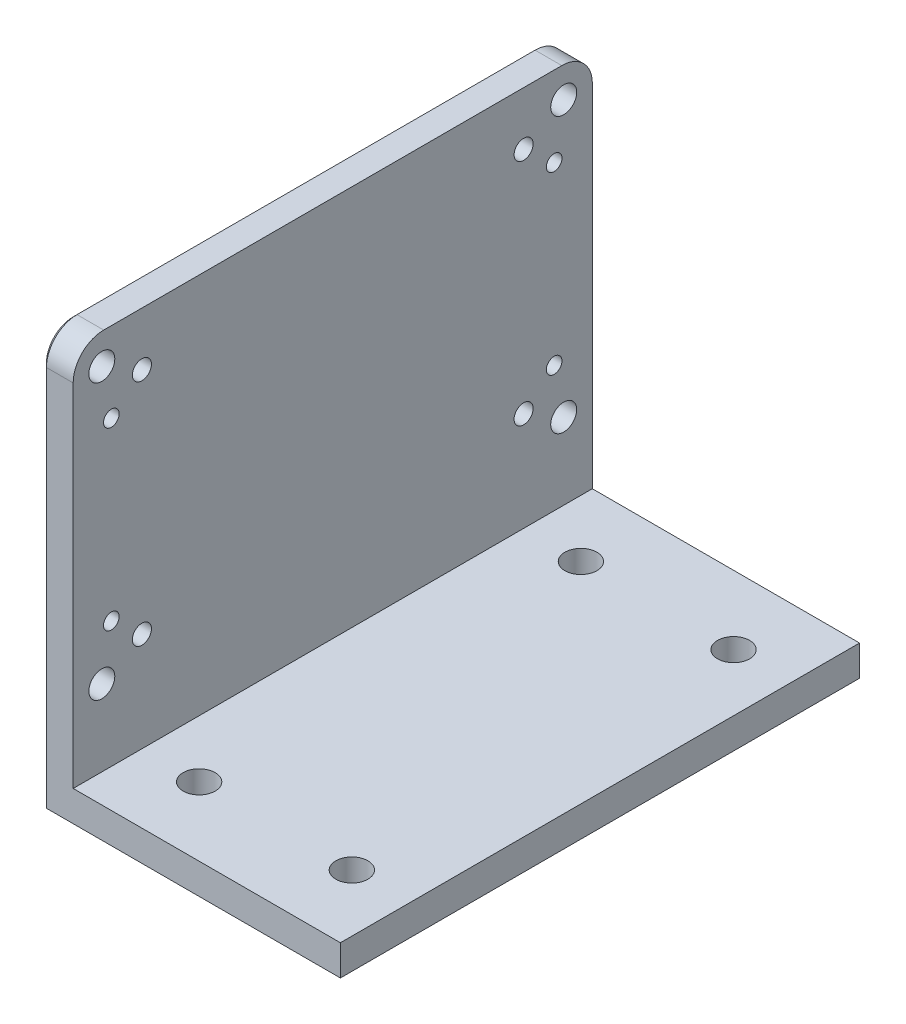
from build123d import *

# Parameters (mm, degrees)
BOSS_EXTRUDE1_DEPTH          = 68
M3_CLEARANCE_HOLE1_D         = 3.4
M3_CLEARANCE_HOLE1_DEPTH     = 5
M3_CLEARANCE_HOLE1_TIP       = 1.021463052
M5X0_8_TAPPED_HOLE1_D        = 4.2
M5X0_8_TAPPED_HOLE1_DEPTH    = 14
M5X0_8_TAPPED_HOLE1_TIP      = 1.2618073
FILLET1_R                    = 4
CHAMFER1_SIZE                = 0.5
M2_5X0_45_TAPPED_HOLE1_D     = 2.05
M2_5X0_45_TAPPED_HOLE1_DEPTH = 7.25
M2_5X0_45_TAPPED_HOLE1_TIP   = 0.615882135
M3X0_5_TAPPED_HOLE3_D        = 2.5
M3X0_5_TAPPED_HOLE3_DEPTH    = 8.5
M3X0_5_TAPPED_HOLE3_TIP      = 0.751075774


with BuildPart() as part:
    # Sketch1 → Boss-Extrude1 (new body)
    with BuildSketch(Plane.XY):
        Polygon((0, 0), (39, 0), (39, 4), (4, 4), (4, 54), (0, 54), align=None)
    extrude(amount=BOSS_EXTRUDE1_DEPTH)

    # M3 Clearance Hole1
    with Locations(Plane(origin=(4, 0, 0), x_dir=(0, 0, -1), z_dir=(1, 0, 0))):
        with Locations((-64.25, 50), (-3.75, 50), (-3.75, 14), (-64.25, 14)):
            Hole(M3_CLEARANCE_HOLE1_D / 2, depth=M3_CLEARANCE_HOLE1_DEPTH)
            with Locations((0, 0, -(M3_CLEARANCE_HOLE1_DEPTH + M3_CLEARANCE_HOLE1_TIP / 2))):  # 118° drill point
                Cone(0, M3_CLEARANCE_HOLE1_D / 2, M3_CLEARANCE_HOLE1_TIP, mode=Mode.SUBTRACT)

    # M5x0.8 Tapped Hole1
    with Locations(Plane(origin=(0, 4, 0), x_dir=(1, 0, 0), z_dir=(0, 1, 0))):
        with Locations((31.5, -59), (11.5, -59), (11.5, -9), (31.5, -9)):
            Hole(M5X0_8_TAPPED_HOLE1_D / 2, depth=M5X0_8_TAPPED_HOLE1_DEPTH)
            with Locations((0, 0, -(M5X0_8_TAPPED_HOLE1_DEPTH + M5X0_8_TAPPED_HOLE1_TIP / 2))):  # 118° drill point
                Cone(0, M5X0_8_TAPPED_HOLE1_D / 2, M5X0_8_TAPPED_HOLE1_TIP, mode=Mode.SUBTRACT)

    # Fillet1
    fillet1_edges = [part.edges().sort_by_distance(p)[0] for p in [
        (2, 54, 68),
        (2, 54, 0),
    ]]
    fillet(fillet1_edges, radius=FILLET1_R)

    # Chamfer1
    chamfer1_edges = [part.edges().sort_by_distance(p)[0] for p in [
        (0, 25, 68),
        (0, 25, 0),
        (0, 54, 34),
        (0, 52.828427125, 1.171572875),
        (0, 52.828427125, 66.828427125),
    ]]
    chamfer(chamfer1_edges, length=CHAMFER1_SIZE)

    # M2.5x0.45 Tapped Hole1
    with Locations(Plane.ZY):
        with Locations((5, 43.5), (63, 43.5), (63, 20.5), (5, 20.5)):
            Hole(M2_5X0_45_TAPPED_HOLE1_D / 2, depth=M2_5X0_45_TAPPED_HOLE1_DEPTH)
            with Locations((0, 0, -(M2_5X0_45_TAPPED_HOLE1_DEPTH + M2_5X0_45_TAPPED_HOLE1_TIP / 2))):  # 118° drill point
                Cone(0, M2_5X0_45_TAPPED_HOLE1_D / 2, M2_5X0_45_TAPPED_HOLE1_TIP, mode=Mode.SUBTRACT)

    # M3x0.5 Tapped Hole3
    with Locations(Plane.ZY):
        with Locations((9, 17), (9, 47), (59, 47), (59, 17)):
            Hole(M3X0_5_TAPPED_HOLE3_D / 2, depth=M3X0_5_TAPPED_HOLE3_DEPTH)
            with Locations((0, 0, -(M3X0_5_TAPPED_HOLE3_DEPTH + M3X0_5_TAPPED_HOLE3_TIP / 2))):  # 118° drill point
                Cone(0, M3X0_5_TAPPED_HOLE3_D / 2, M3X0_5_TAPPED_HOLE3_TIP, mode=Mode.SUBTRACT)


solid = part.part
